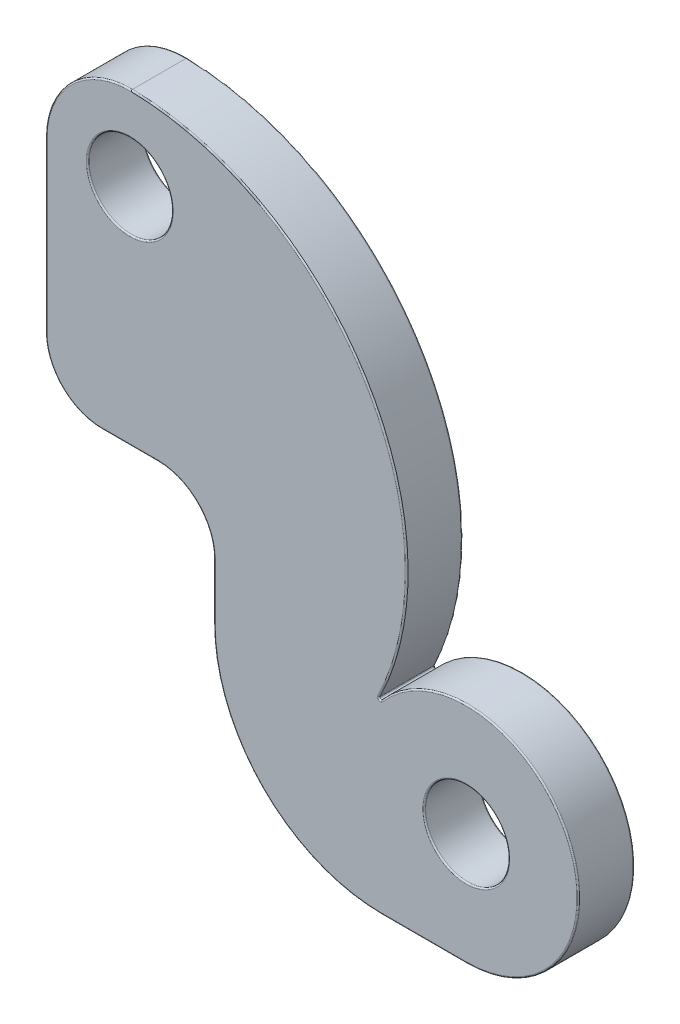
from build123d import *

# Parameters (mm, degrees)
SKETCH1_R           = 7.5
BOSS_EXTRUDE1_DEPTH = 10
FILLET1_R           = 0.25


with BuildPart() as part:
    # Sketch1 → Boss-Extrude1 (new body)
    with BuildSketch(Plane.XY):
        with BuildLine():
            Line((-15, 0), (-15, -30))
            ThreePointArc((-15, -30), (-12.071067812, -37.071067812), (-5, -40))
            Line((-5, -40), (5, -40))
            ThreePointArc((5, -40), (12.071067812, -42.928932188), (15, -50))
            Line((15, -50), (15, -60))
            ThreePointArc((15, -60), (23.786796564, -81.213203436), (45, -90))
            Line((45, -90), (60, -90))
            ThreePointArc((60, -90), (77.320959018, -60.000781096), (42.680393915, -59.998437869))
            ThreePointArc((42.680393915, -59.998437869), (42.903012663, -10.380159149), (0.265123413, 14.997656803))
            ThreePointArc((0.265123413, 14.997656803), (-10.512448545, 10.699926429), (-15, 0))
        make_face()
        Circle(SKETCH1_R, mode=Mode.SUBTRACT)
        with Locations((60, -70)):
            Circle(SKETCH1_R, mode=Mode.SUBTRACT)
    extrude(amount=BOSS_EXTRUDE1_DEPTH)

    # Fillet1
    fillet1_edges = [part.edges().sort_by_distance(p)[0] for p in [
        (42.903012663, -10.380159149, 0),
        (77.320959018, -60.000781096, 0),
        (52.5, -90, 0),
        (23.786796564, -81.213203436, 0),
        (15, -55, 0),
        (12.071067812, -42.928932188, 0),
        (0, -40, 0),
        (-12.071067812, -37.071067812, 10),
        (-12.071067812, -37.071067812, 0),
        (-15, -15, 0),
        (-10.512448545, 10.699926429, 0),
        (0, -40, 10),
        (42.680393915, -59.998437869, 5),
        (12.071067812, -42.928932188, 10),
        (15, -55, 10),
        (-7.5, 0, 0),
        (-7.5, 0, 10),
        (23.786796564, -81.213203436, 10),
        (52.5, -70, 0),
        (52.5, -70, 10),
        (52.5, -90, 10),
        (77.320959018, -60.000781096, 10),
        (42.903012663, -10.380159149, 10),
        (-10.512448545, 10.699926429, 10),
        (-15, -15, 10),
    ]]
    fillet(fillet1_edges, radius=FILLET1_R)


solid = part.part
